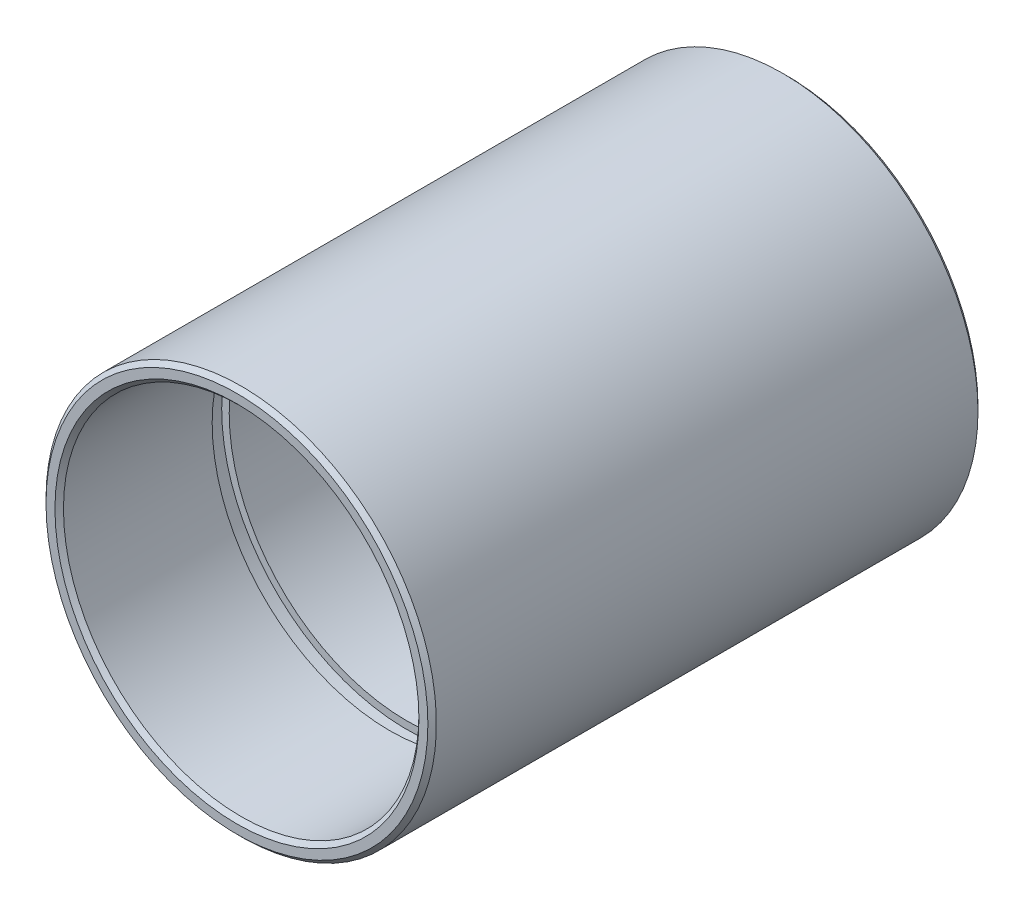
from build123d import *

# Parameters (mm, degrees)
SKETCH1_R          = 17.4625
SKETCH1_R_2        = 15.9004
BASE_EXTRUDE_DEPTH = 49.2125
SKETCH2_R          = 16.5735
CUT_EXTRUDE1_DEPTH = 1.524
CUT_EXTRUDE2_START = 1.524
SKETCH3_R          = 16.5735
CUT_EXTRUDE2_DEPTH = 1.524
CHAMFER1_SIZE      = 0.381


with BuildPart() as part:
    # Sketch1 → Base-Extrude (new body)
    with BuildSketch(Plane.XY):
        Circle(SKETCH1_R)
        Circle(SKETCH1_R_2, mode=Mode.SUBTRACT)
    extrude(amount=BASE_EXTRUDE_DEPTH)

    # Sketch2 → Cut-Extrude1 (cut)
    with BuildSketch(Plane.XY.offset(15.20825)):
        Circle(SKETCH2_R)
    extrude(amount=-CUT_EXTRUDE1_DEPTH, mode=Mode.SUBTRACT)

    # Sketch3 → Cut-Extrude2 (cut)
    with BuildSketch(Plane.XY.offset(34.00425).offset(CUT_EXTRUDE2_START)):
        Circle(SKETCH3_R)
    extrude(amount=-CUT_EXTRUDE2_DEPTH, mode=Mode.SUBTRACT)

    # Chamfer1
    chamfer1_edges = [part.edges().sort_by_distance(p)[0] for p in [
        (-17.4625, 0, 0),
        (-17.4625, 0, 49.2125),
        (-15.9004, 0, 0),
        (-15.9004, 0, 49.2125),
    ]]
    chamfer(chamfer1_edges, length=CHAMFER1_SIZE)


solid = part.part
